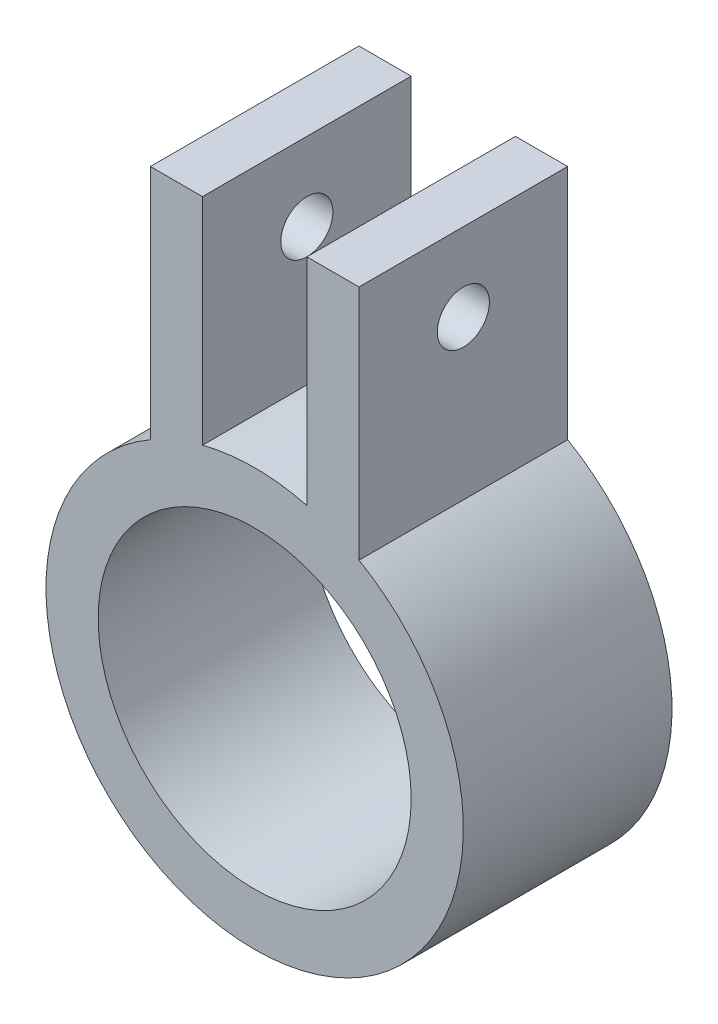
from build123d import *

# Parameters (mm, degrees)
EXTRUDE_4_DEPTH     = 4
SKETCH_5_R          = 0.5
CUT_EXTRUDE_2_DEPTH = 4


with BuildPart() as part:
    # 草图1 → 凸台-拉伸4 (new body)
    with BuildSketch(Plane.XY):
        with BuildLine():
            Line((2, 3.464101615), (2, 2.236067977))
            ThreePointArc((2, 2.236067977), (2.738612788, 1.224744871), (3, 0))
            ThreePointArc((3, 0), (-1.224744871, -2.738612788), (-2, 2.236067977))
            Line((-2, 2.236067977), (-2, 3.464101615))
            ThreePointArc((-2, 3.464101615), (-2, -3.464101615), (4, 0))
            ThreePointArc((4, 0), (3.464101615, 2), (2, 3.464101615))
        make_face()
        with BuildLine():
            Line((1, 3), (0, 3))
            ThreePointArc((0, 3), (1.070466269, 2.802517077), (2, 2.236067977))
            Line((2, 2.236067977), (2, 3.464101615))
            ThreePointArc((2, 3.464101615), (1.513867916, 3.702459174), (1, 3.872983346))
            Line((1, 3.872983346), (1, 3))
        make_face()
        with BuildLine():
            ThreePointArc((-2, 2.236067977), (-1.070466269, 2.802517077), (0, 3))
            Line((0, 3), (-1, 3))
            Line((-1, 3), (-1, 3.872983346))
            ThreePointArc((-1, 3.872983346), (-1.513867916, 3.702459174), (-2, 3.464101615))
            Line((-2, 3.464101615), (-2, 2.236067977))
        make_face()
        with BuildLine():
            Line((-1, 3), (0, 3))
            Line((0, 3), (0, 4))
            ThreePointArc((0, 4), (-0.50401717, 3.968118785), (-1, 3.872983346))
            Line((-1, 3.872983346), (-1, 3))
        make_face()
        with BuildLine():
            Line((0, 4), (0, 3))
            Line((0, 3), (1, 3))
            Line((1, 3), (1, 3.872983346))
            ThreePointArc((1, 3.872983346), (0.50401717, 3.968118785), (0, 4))
        make_face()
        with BuildLine():
            Line((1, 8), (1, 3.872983346))
            ThreePointArc((1, 3.872983346), (1.513867916, 3.702459174), (2, 3.464101615))
            Line((2, 3.464101615), (2, 8))
            Line((2, 8), (1, 8))
        make_face()
        with BuildLine():
            ThreePointArc((-2, 3.464101615), (-1.513867916, 3.702459174), (-1, 3.872983346))
            Line((-1, 3.872983346), (-1, 8))
            Line((-1, 8), (-2, 8))
            Line((-2, 8), (-2, 3.464101615))
        make_face()
    extrude(amount=EXTRUDE_4_DEPTH)

    # 草图5 → 切除-拉伸2 (cut)
    with BuildSketch(Plane.ZY.offset(2)):
        with Locations((2, 6.5)):
            Circle(SKETCH_5_R)
    extrude(amount=-CUT_EXTRUDE_2_DEPTH, mode=Mode.SUBTRACT)


solid = part.part
